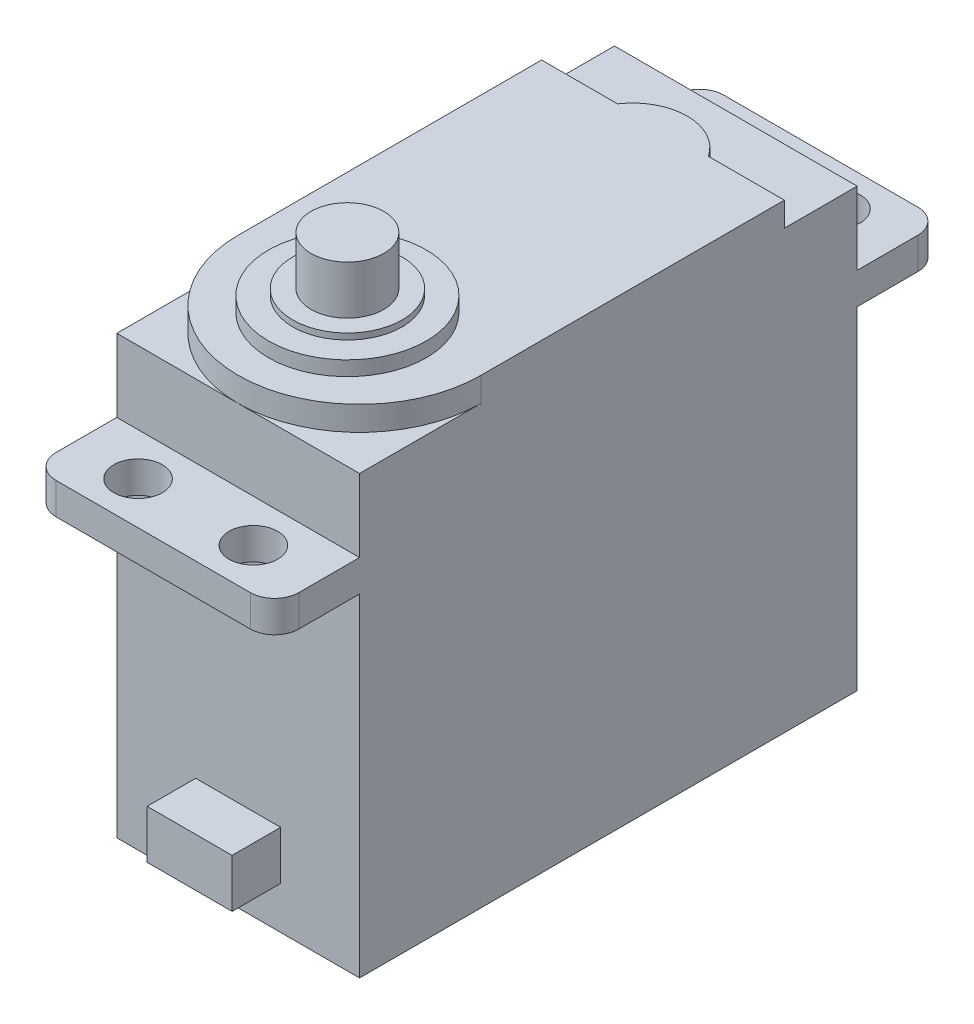
from build123d import *

# Parameters (mm, degrees)
AUFSATZ_LINEAR_AUSTRAGEN3_DEPTH = 20
AUFSATZ_LINEAR_AUSTRAGEN4_DEPTH = 2
SKIZZE3_R                       = 6.5
AUFSATZ_LINEAR_AUSTRAGEN5_DEPTH = 1.2
SCHNITT_LINEAR_AUSTRAGEN1_REACH = 53.652
SKIZZE4_R                       = 2
SKIZZE6_W                       = 7
SKIZZE6_H                       = 4
AUFSATZ_LINEAR_AUSTRAGEN6_DEPTH = 4
SKIZZE7_R                       = 4.5
AUFSATZ_LINEAR_AUSTRAGEN7_DEPTH = 0.5
SKIZZE8_R                       = 3
AUFSATZ_LINEAR_AUSTRAGEN8_DEPTH = 4
VERRUNDUNG3_R                   = 2


with BuildPart() as part:
    # Skizze1 → Aufsatz-Linear austragen3 (new body)
    with BuildSketch(Plane(origin=(0, 0, 0), x_dir=(0, 0, -1), z_dir=(1, 0, 0))):
        Polygon((-11.014679398, 22.752092755), (-11.014679398, 28.752092755), (29.985320602, 28.752092755), (29.985320602, 22.752092755), (36.985320602, 22.752092755), (36.985320602, 20.152092755), (29.985320602, 20.152092755), (29.985320602, -7.247907245), (-11.014679398, -7.247907245), (-11.014679398, 20.152092755), (-18.014679398, 20.152092755), (-18.014679398, 22.752092755), align=None)
    extrude(amount=AUFSATZ_LINEAR_AUSTRAGEN3_DEPTH)

    # Skizze2 → Aufsatz-Linear austragen4 (add)
    with BuildSketch(Plane(origin=(0, 28.752092755, 0), x_dir=(1, 0, 0), z_dir=(0, 1, 0))):
        with BuildLine():
            Line((0, -1.014679398), (0, 23.985320602))
            Line((0, 23.985320602), (6.258342613, 23.985320602))
            ThreePointArc((6.258342613, 23.985320602), (10, 25.985320602), (13.741657387, 23.985320602))
            Line((13.741657387, 23.985320602), (20, 23.985320602))
            Line((20, 23.985320602), (20, -1.014679398))
            ThreePointArc((20, -1.014679398), (10, -11.014679398), (0, -1.014679398))
        make_face()
    extrude(amount=AUFSATZ_LINEAR_AUSTRAGEN4_DEPTH)

    # Skizze3 → Aufsatz-Linear austragen5 (add)
    with BuildSketch(Plane(origin=(0, 30.752092755, 0), x_dir=(1, 0, 0), z_dir=(0, 1, 0))):
        with Locations(Location((10, -2.014679398, 0), (0, 0, 270))):
            Circle(SKIZZE3_R)
    extrude(amount=AUFSATZ_LINEAR_AUSTRAGEN5_DEPTH)

    # Skizze4 → Schnitt-Linear austragen1 (cut, up to next)
    with BuildSketch(Plane(origin=(0, 22.752092755, 0), x_dir=(1, 0, 0), z_dir=(0, 1, 0)), mode=Mode.PRIVATE) as schnitt_linear_austragen1_sk1:
        with Locations(Location((5.25, -14.514679398, 0), (0, 0, 270))):
            Circle(SKIZZE4_R)
    schnitt_linear_austragen1_tool1 = extrude(schnitt_linear_austragen1_sk1.sketch, amount=-SCHNITT_LINEAR_AUSTRAGEN1_REACH, mode=Mode.PRIVATE) & part.part
    # Skizze4 → Schnitt-Linear austragen1 (cut, up to next)
    with BuildSketch(Plane(origin=(0, 22.752092755, 0), x_dir=(1, 0, 0), z_dir=(0, 1, 0)), mode=Mode.PRIVATE) as schnitt_linear_austragen1_sk2:
        with Locations(Location((14.75, -14.514679398, 0), (0, 0, 270))):
            Circle(SKIZZE4_R)
    schnitt_linear_austragen1_tool2 = extrude(schnitt_linear_austragen1_sk2.sketch, amount=-SCHNITT_LINEAR_AUSTRAGEN1_REACH, mode=Mode.PRIVATE) & part.part
    # Skizze4 → Schnitt-Linear austragen1 (cut, up to next)
    with BuildSketch(Plane(origin=(0, 22.752092755, 0), x_dir=(1, 0, 0), z_dir=(0, 1, 0)), mode=Mode.PRIVATE) as schnitt_linear_austragen1_sk3:
        with Locations(Location((14.75, 33.485320602, 0), (0, 0, 270))):
            Circle(SKIZZE4_R)
    schnitt_linear_austragen1_tool3 = extrude(schnitt_linear_austragen1_sk3.sketch, amount=-SCHNITT_LINEAR_AUSTRAGEN1_REACH, mode=Mode.PRIVATE) & part.part
    # Skizze4 → Schnitt-Linear austragen1 (cut, up to next)
    with BuildSketch(Plane(origin=(0, 22.752092755, 0), x_dir=(1, 0, 0), z_dir=(0, 1, 0)), mode=Mode.PRIVATE) as schnitt_linear_austragen1_sk4:
        with Locations(Location((5.25, 33.485320602, 0), (0, 0, 270))):
            Circle(SKIZZE4_R)
    schnitt_linear_austragen1_tool4 = extrude(schnitt_linear_austragen1_sk4.sketch, amount=-SCHNITT_LINEAR_AUSTRAGEN1_REACH, mode=Mode.PRIVATE) & part.part
    add(schnitt_linear_austragen1_tool1.solids().sort_by_distance((5.25, 22.752093, 14.514679))[0], mode=Mode.SUBTRACT)
    add(schnitt_linear_austragen1_tool2.solids().sort_by_distance((14.75, 22.752093, 14.514679))[0], mode=Mode.SUBTRACT)
    add(schnitt_linear_austragen1_tool3.solids().sort_by_distance((14.75, 22.752093, -33.485321))[0], mode=Mode.SUBTRACT)
    add(schnitt_linear_austragen1_tool4.solids().sort_by_distance((5.25, 22.752093, -33.485321))[0], mode=Mode.SUBTRACT)

    # Skizze6 → Aufsatz-Linear austragen6 (add)
    with BuildSketch(Plane.XY.offset(11.014679398)):
        with Locations((10, -1.747907245)):
            Rectangle(SKIZZE6_W, SKIZZE6_H)
    extrude(amount=AUFSATZ_LINEAR_AUSTRAGEN6_DEPTH)

    # Skizze7 → Aufsatz-Linear austragen7 (add)
    with BuildSketch(Plane(origin=(0, 31.952092755, 0), x_dir=(1, 0, 0), z_dir=(0, 1, 0))):
        with Locations(Location((10, -2.014679398, 0), (0, 0, 270))):
            Circle(SKIZZE7_R)
    extrude(amount=AUFSATZ_LINEAR_AUSTRAGEN7_DEPTH)

    # Skizze8 → Aufsatz-Linear austragen8 (add)
    with BuildSketch(Plane(origin=(0, 32.452092755, 0), x_dir=(1, 0, 0), z_dir=(0, 1, 0))):
        with Locations(Location((10, -2.014679398, 0), (0, 0, 270))):
            Circle(SKIZZE8_R)
    extrude(amount=AUFSATZ_LINEAR_AUSTRAGEN8_DEPTH)

    # Verrundung3
    verrundung3_edges = [part.edges().sort_by_distance(p)[0] for p in [
        (0, 21.452092755, 18.014679398),
        (0, 21.452092755, -36.985320602),
        (20, 21.452092755, -36.985320602),
        (20, 21.452092755, 18.014679398),
    ]]
    fillet(verrundung3_edges, radius=VERRUNDUNG3_R)


solid = part.part
